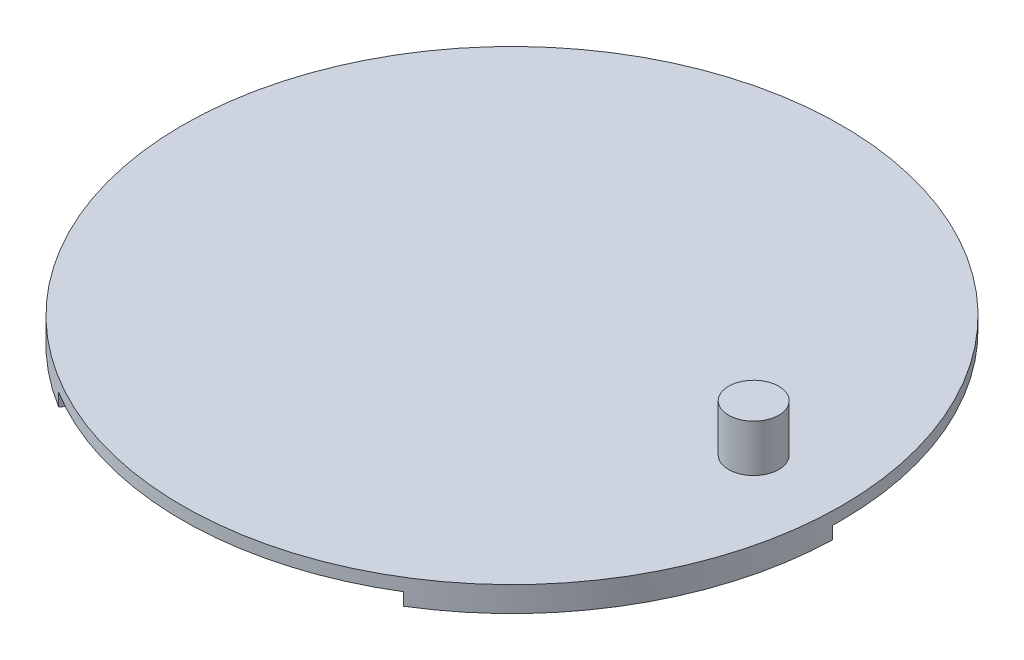
from build123d import *
from build123d.topology import SkipClean

# Parameters (mm, degrees)
SKETCH1_W           = 105
SKETCH1_H           = 8
CUT_EXTRUDE1_START  = -4
CUT_EXTRUDE1_DEPTH  = 4
BOSS_EXTRUDE1_DEPTH = 4
BOSS_EXTRUDE2_DEPTH = 4
SKETCH5_W           = 8
SKETCH5_H           = 15


with BuildPart() as part:
    # Sketch1 → Revolve1 (revolve)
    with BuildSketch(Plane.XY):
        with Locations((52.5, 4)):
            Rectangle(SKETCH1_W, SKETCH1_H)
    revolve(axis=Axis((0, 8, 0), (0, -1, 0)))

    # Sketch2 → Cut-Extrude1 (cut)
    with BuildSketch(Plane.XZ.offset(CUT_EXTRUDE1_START)):
        with BuildLine():
            Line((47.488838396, 79.379217858), (54.960927959, 89.466733471))
            ThreePointArc((54.960927959, 89.466733471), (-90.932667397, -52.5), (104.960927959, 2.864193092))
            Line((104.960927959, 2.864193092), (92.488838396, 1.436931518))
            ThreePointArc((92.488838396, 1.436931518), (80.10734985, 46.25), (47.488838396, 79.379217858))
        make_face()
    extrude(amount=CUT_EXTRUDE1_DEPTH, mode=Mode.SUBTRACT)

    # Sketch3 → Boss-Extrude1 (add)
    with SkipClean():  # the faces are left unmerged after this step: merging them gives an invalid solid
        with BuildSketch(Plane.XZ.offset(-4)):
            with BuildLine():
                Line((-92.488838396, 1.436931518), (-104.960927959, 2.864193092))
                ThreePointArc((-104.960927959, 2.864193092), (-90.932667397, 52.5), (-54.960927959, 89.466733471))
                Line((-54.960927959, 89.466733471), (-47.488838396, 79.379217858))
                ThreePointArc((-47.488838396, 79.379217858), (-80.10734985, 46.25), (-92.488838396, 1.436931518))
            make_face()
        extrude(amount=BOSS_EXTRUDE1_DEPTH)

    # Sketch4 → Boss-Extrude2 (add)
    with SkipClean():  # the faces are left unmerged after this step: merging them gives an invalid solid
        with BuildSketch(Plane.XZ.offset(-4)):
            with BuildLine():
                Line((-50, -92.330926563), (-45, -80.816149376))
                ThreePointArc((-45, -80.816149376), (0, -92.5), (45, -80.816149376))
                Line((45, -80.816149376), (50, -92.330926563))
                ThreePointArc((50, -92.330926563), (0, -105), (-50, -92.330926563))
            make_face()
        extrude(amount=BOSS_EXTRUDE2_DEPTH)

    # Sketch5 → Revolve2 (revolve)
    with SkipClean():  # the faces are left unmerged after this step: merging them gives an invalid solid
        with BuildSketch(Plane.XY, mode=Mode.PRIVATE) as revolve2_sk:
            with Locations((81, 15.5)):
                Rectangle(SKETCH5_W, SKETCH5_H)
        revolve(revolve2_sk.sketch.rotate(Axis((77, 23, 0), (0, -1, 0)), 270), axis=Axis((77, 23, 0), (0, -1, 0)))


solid = part.part
